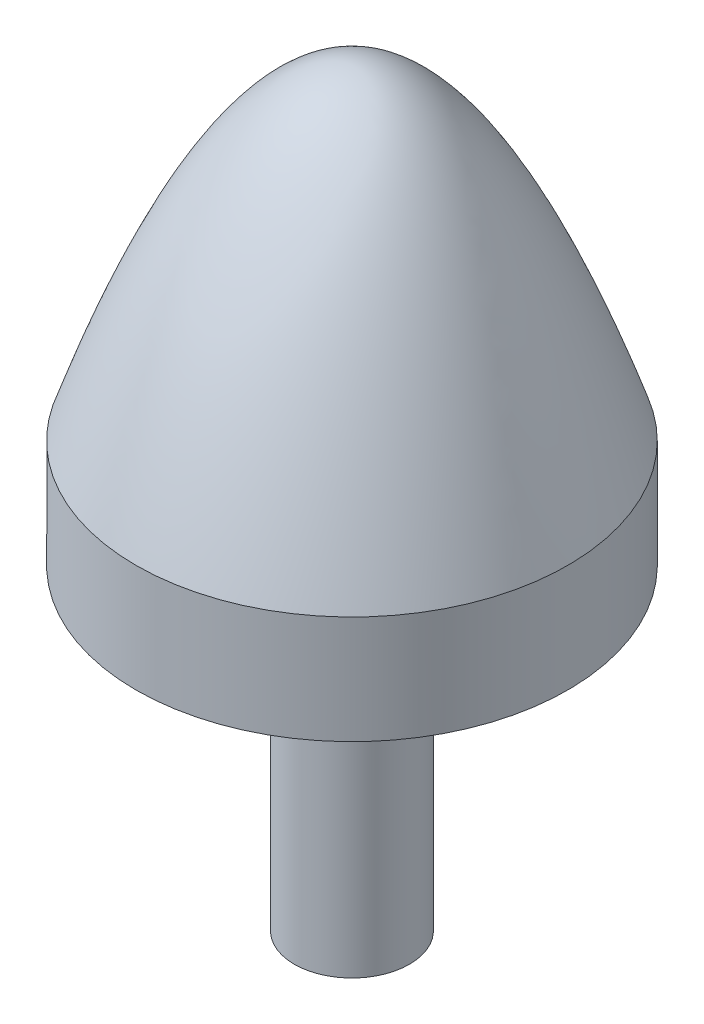
from build123d import *

# Parameters (mm, degrees)
SKETCH2_R     = 8.953574076
POSTCUT_DEPTH = 3


with BuildPart() as part:
    # Sketch1 → Revolve1 (revolve)
    with BuildSketch(Plane.XY, mode=Mode.PRIVATE) as revolve1_sk:
        with BuildLine():
            Line((0, 30), (0, 0))
            Line((0, 0), (0, -25))
            Line((0, -25), (-4, -25))
            Line((-4, -25), (-4, 0))
            Line((-4, 0), (-15, 0))
            Line((-15, 0), (-15, 7.5))
            add(Edge.make_bspline(
                [(-15, 7.5), (-7.5, 30), (0, 30)],
                knots=[0.050263243, 0.050263243, 0.050263243, 0.913660295, 0.913660295, 0.913660295], degree=2))
        make_face()
    revolve(revolve1_sk.sketch.rotate(Axis((0, 30, 0), (0, -1, 0)), 270), axis=Axis((0, 30, 0), (0, -1, 0)))

    # Sketch2 → PostCut (cut)
    with BuildSketch(Plane(origin=(0, -25, 0), x_dir=(-1, 0, 0), z_dir=(0, -1, 0))):
        Circle(SKETCH2_R)
    extrude(amount=-POSTCUT_DEPTH, mode=Mode.SUBTRACT)


solid = part.part
